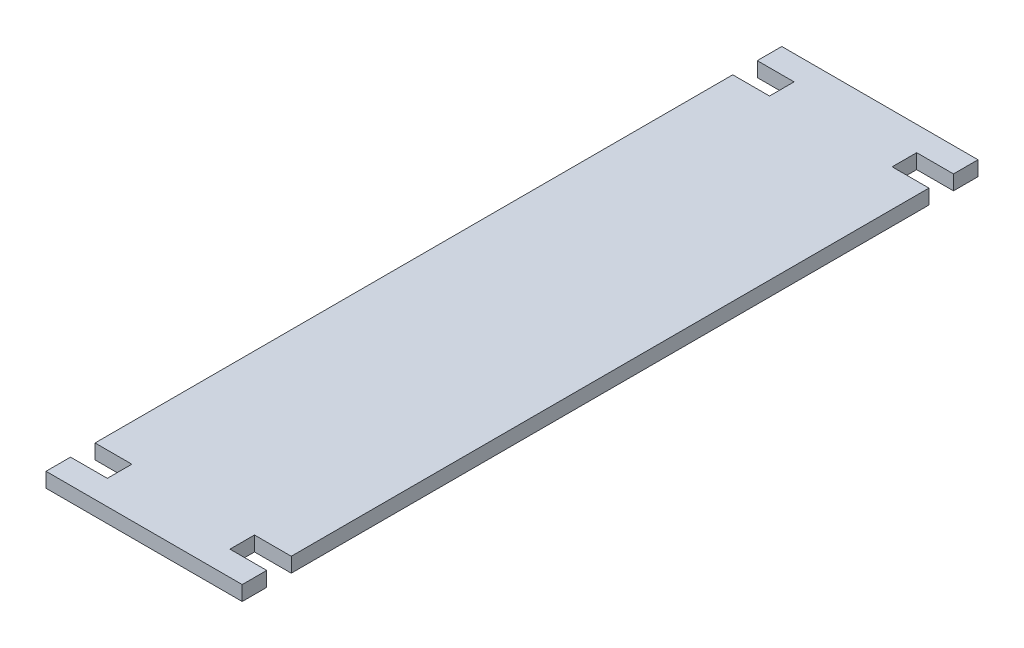
from build123d import *

# Parameters (mm, degrees)
SKETCH1_W           = 40
SKETCH1_H           = 150
BOSS_EXTRUDE1_DEPTH = 3
SKETCH2_W           = 7.5
SKETCH2_H           = 5
CUT_EXTRUDE1_DEPTH  = 10


with BuildPart() as part:
    # Sketch1 → Boss-Extrude1 (new body)
    with BuildSketch(Plane(origin=(0, 0, 0), x_dir=(1, 0, 0), z_dir=(0, 1, 0))):
        with Locations((20, 75)):
            Rectangle(SKETCH1_W, SKETCH1_H)
    extrude(amount=BOSS_EXTRUDE1_DEPTH)

    # Sketch2 → Cut-Extrude1 (cut)
    with BuildSketch(Plane(origin=(0, 0, 0), x_dir=(1, 0, 0), z_dir=(0, 1, 0))):
        with Locations((3.75, 142.5)):
            Rectangle(SKETCH2_W, SKETCH2_H)
        with Locations((36.25, 7.5)):
            Rectangle(SKETCH2_W, SKETCH2_H)
        with Locations((3.75, 7.5)):
            Rectangle(SKETCH2_W, SKETCH2_H)
        with Locations((36.25, 142.5)):
            Rectangle(SKETCH2_W, SKETCH2_H)
    extrude(amount=CUT_EXTRUDE1_DEPTH, mode=Mode.SUBTRACT)


solid = part.part
